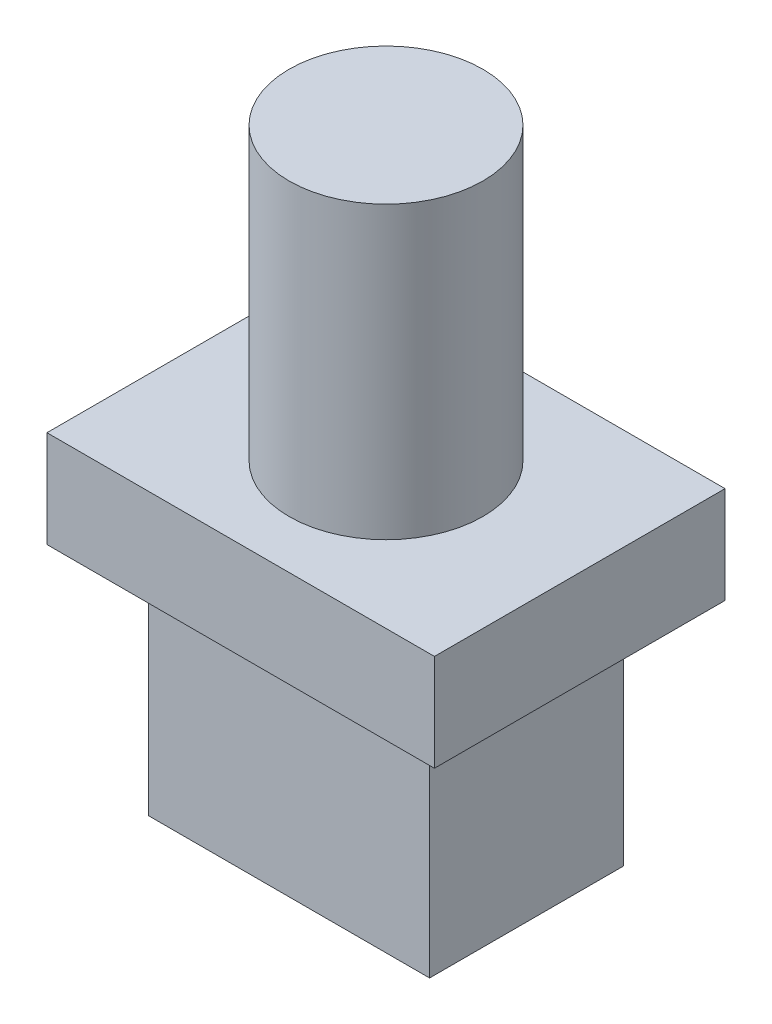
from build123d import *

# Parameters (mm, degrees)
SKETCH_1_W      = 29
SKETCH_1_H      = 20
EXTRUDE_1_DEPTH = 24
SKETCH_2_W      = 14.5
SKETCH_2_H      = 10
SKETCH_2_W_2    = 5.5
EXTRUDE_2_DEPTH = 10
EXTRUDE_3_DEPTH = 30


with BuildPart() as part:
    # 草图1 → 凸台-拉伸1 (new body)
    with BuildSketch(Plane(origin=(0, 0, 0), x_dir=(1, 0, 0), z_dir=(0, 1, 0))):
        with Locations((14.5, 10)):
            Rectangle(SKETCH_1_W, SKETCH_1_H)
    extrude(amount=EXTRUDE_1_DEPTH)

    # 草图2 → 凸台-拉伸2 (add)
    with BuildSketch(Plane(origin=(0, 24, 0), x_dir=(1, 0, 0), z_dir=(0, 1, 0))):
        with Locations((7.25, 5)):
            Rectangle(SKETCH_2_W, SKETCH_2_H)
        Polygon((0, 0), (0, 10), (0, 20), (14.5, 20), (29, 20), (29, 10), (34.5, 10), (34.5, 25), (-5.5, 25), (-5.5, -5), (34.5, -5), (34.5, 0), (29, 0), (14.5, 0), align=None)
        with Locations((21.75, 5)):
            Rectangle(SKETCH_2_W, SKETCH_2_H)
        with Locations((31.75, 5)):
            Rectangle(SKETCH_2_W_2, SKETCH_2_H)
        with Locations((21.75, 15)):
            Rectangle(SKETCH_2_W, SKETCH_2_H)
        with Locations((7.25, 15)):
            Rectangle(SKETCH_2_W, SKETCH_2_H)
    extrude(amount=EXTRUDE_2_DEPTH)

    # 草图3 → 凸台-拉伸3 (add)
    with BuildSketch(Plane(origin=(0, 34, 0), x_dir=(1, 0, 0), z_dir=(0, 1, 0))):
        with BuildLine():
            ThreePointArc((14.5, 20), (7.428932188, 17.071067812), (4.5, 10))
            Line((4.5, 10), (14.5, 10))
            Line((14.5, 10), (14.5, 20))
        make_face()
        with BuildLine():
            Line((14.5, 10), (4.5, 10))
            ThreePointArc((4.5, 10), (7.428932188, 2.928932188), (14.5, 0))
            Line((14.5, 0), (14.5, 10))
        make_face()
        with BuildLine():
            Line((14.5, 20), (14.5, 10))
            Line((14.5, 10), (24.5, 10))
            ThreePointArc((24.5, 10), (21.571067812, 17.071067812), (14.5, 20))
        make_face()
        with BuildLine():
            Line((24.5, 10), (14.5, 10))
            Line((14.5, 10), (14.5, 0))
            ThreePointArc((14.5, 0), (21.571067812, 2.928932188), (24.5, 10))
        make_face()
    extrude(amount=EXTRUDE_3_DEPTH)


solid = part.part
